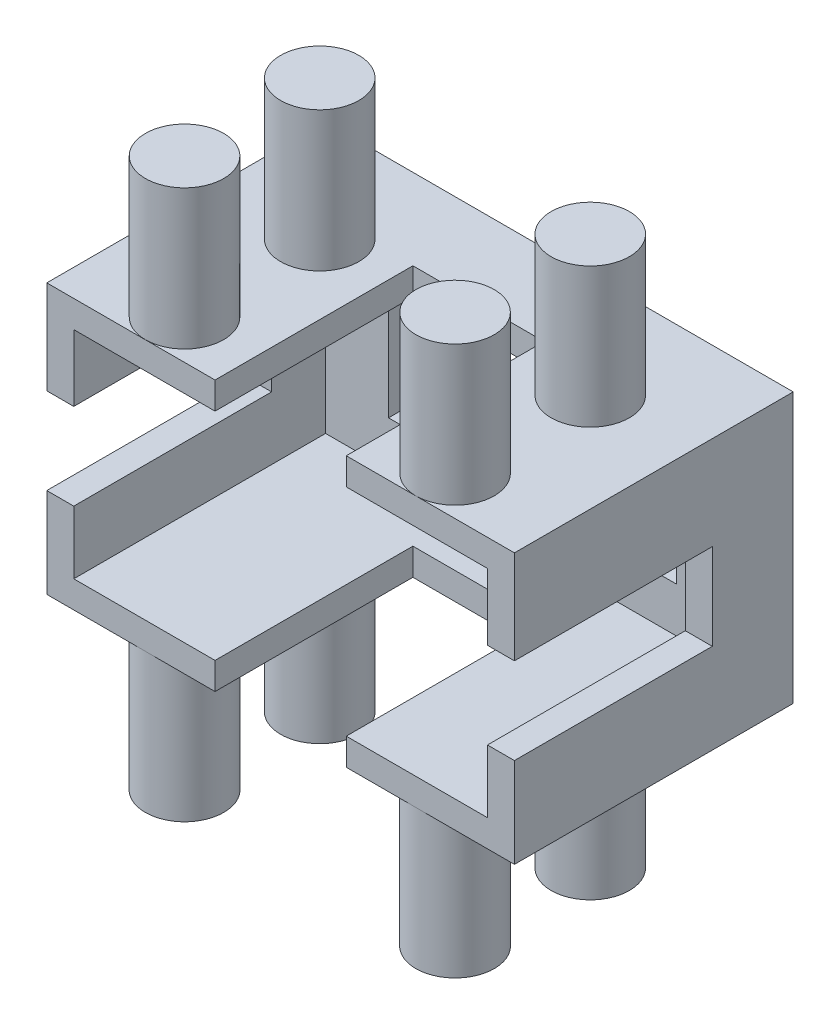
from build123d import *

# Parameters (mm, degrees)
SKETCH1_W           = 26
SKETCH1_H           = 15
BOSS_EXTRUDE1_DEPTH = 17.4
SKETCH3_W           = 23
SKETCH3_H           = 12
CUT_EXTRUDE1_DEPTH  = 15.9
SKETCH5_W           = 12
SKETCH5_H           = 12.9
CUT_EXTRUDE2_DEPTH  = 15.9
SKETCH8_W           = 12.9
SKETCH8_H           = 4.8
CUT_EXTRUDE4_DEPTH  = 1000
SKETCH9_W           = 16
SKETCH9_H           = 6.8
CUT_EXTRUDE5_DEPTH  = 1000
SKETCH10_W          = 1.9
SKETCH10_H          = 15
CUT_EXTRUDE6_DEPTH  = 1000
SKETCH11_R          = 2.175
BOSS_EXTRUDE2_DEPTH = 7.76
BOSS_EXTRUDE3_START = 7.76
SKETCH12_R          = 2.175
SKETCH12_R_2        = 2.18
BOSS_EXTRUDE3_DEPTH = 7.76
SKETCH13_W          = 12
SKETCH13_H          = 11
BOSS_EXTRUDE5_DEPTH = 1.5
SKETCH14_W          = 12
SKETCH14_H          = 11
BOSS_EXTRUDE6_DEPTH = 1.5
SKETCH17_W          = 7.294957973
SKETCH17_H          = 11
CUT_EXTRUDE7_DEPTH  = 50


with BuildPart() as part:
    # Sketch1 → Boss-Extrude1 (new body)
    with BuildSketch(Plane.XY):
        with Locations((13, 7.5)):
            Rectangle(SKETCH1_W, SKETCH1_H)
    extrude(amount=BOSS_EXTRUDE1_DEPTH)

    # Sketch3 → Cut-Extrude1 (cut)
    with BuildSketch(Plane.XY.offset(17.4)):
        with Locations((13, 7.5)):
            Rectangle(SKETCH3_W, SKETCH3_H)
    extrude(amount=-CUT_EXTRUDE1_DEPTH, mode=Mode.SUBTRACT)

    # Sketch5 → Cut-Extrude2 (cut)
    with BuildSketch(Plane.XZ):
        with Locations((13, 10.95)):
            Rectangle(SKETCH5_W, SKETCH5_H)
    extrude(amount=-CUT_EXTRUDE2_DEPTH, mode=Mode.SUBTRACT)

    # Sketch8 → Cut-Extrude4 (cut)
    with BuildSketch(Plane.ZY):
        with Locations((10.95, 7.4)):
            Rectangle(SKETCH8_W, SKETCH8_H)
    extrude(amount=-CUT_EXTRUDE4_DEPTH, mode=Mode.SUBTRACT)

    # Sketch9 → Cut-Extrude5 (cut)
    with BuildSketch(Plane(origin=(0, 0, 0), x_dir=(-1, 0, 0), z_dir=(0, 0, -1))):
        with Locations((-13, 7.4)):
            Rectangle(SKETCH9_W, SKETCH9_H)
    extrude(amount=-CUT_EXTRUDE5_DEPTH, mode=Mode.SUBTRACT)

    # Sketch10 → Cut-Extrude6 (cut)
    with BuildSketch(Plane.ZY):
        with Locations((16.45, 7.5)):
            Rectangle(SKETCH10_W, SKETCH10_H)
    extrude(amount=-CUT_EXTRUDE6_DEPTH, mode=Mode.SUBTRACT)

    # Sketch11 → Boss-Extrude2 (add)
    with BuildSketch(Plane(origin=(0, 15, 0), x_dir=(1, 0, 0), z_dir=(0, 1, 0))):
        with Locations(Location((20.52, -5.805, 0), (0, 0, 143.130102354))):
            Circle(SKETCH11_R)
        with Locations(Location((20.52, -13.32, 0), (0, 0, 134.33485804))):
            Circle(SKETCH11_R)
        with Locations(Location((5.48, -5.805, 0), (0, 0, 90))):
            Circle(SKETCH11_R)
        with Locations(Location((5.48, -13.32, 0), (0, 0, 90))):
            Circle(SKETCH11_R)
    extrude(amount=BOSS_EXTRUDE2_DEPTH)

    # Sketch12 → Boss-Extrude3 (add)
    with BuildSketch(Plane(origin=(0, 0, 0), x_dir=(-1, 0, 0), z_dir=(0, -1, 0)).offset(BOSS_EXTRUDE3_START)):
        with Locations(Location((-5.48, -5.805, 0), (0, 0, 90))):
            Circle(SKETCH12_R)
        with Locations(Location((-5.48, -13.32, 0), (0, 0, 270))):
            Circle(SKETCH12_R_2)
        with Locations(Location((-20.52, -5.805, 0), (0, 0, 36.869897646))):
            Circle(SKETCH12_R)
        with Locations(Location((-20.52, -13.32, 0), (0, 0, 270))):
            Circle(SKETCH12_R_2)
    extrude(amount=-BOSS_EXTRUDE3_DEPTH)

    # Sketch13 → Boss-Extrude5 (add)
    with BuildSketch(Plane(origin=(0, 15, 0), x_dir=(1, 0, 0), z_dir=(0, 1, 0))):
        with Locations((13, -10)):
            Rectangle(SKETCH13_W, SKETCH13_H)
    extrude(amount=-BOSS_EXTRUDE5_DEPTH)

    # Sketch14 → Boss-Extrude6 (add)
    with BuildSketch(Plane(origin=(0, 0, 0), x_dir=(-1, 0, 0), z_dir=(0, -1, 0))):
        with Locations((-13, -10)):
            Rectangle(SKETCH14_W, SKETCH14_H)
    extrude(amount=-BOSS_EXTRUDE6_DEPTH)

    # Sketch17 → Cut-Extrude7 (cut)
    with BuildSketch(Plane(origin=(0, 15, 0), x_dir=(1, 0, 0), z_dir=(0, 1, 0))):
        with Locations((13.002478986, -10)):
            Rectangle(SKETCH17_W, SKETCH17_H)
    extrude(amount=-CUT_EXTRUDE7_DEPTH, mode=Mode.SUBTRACT)


solid = part.part
